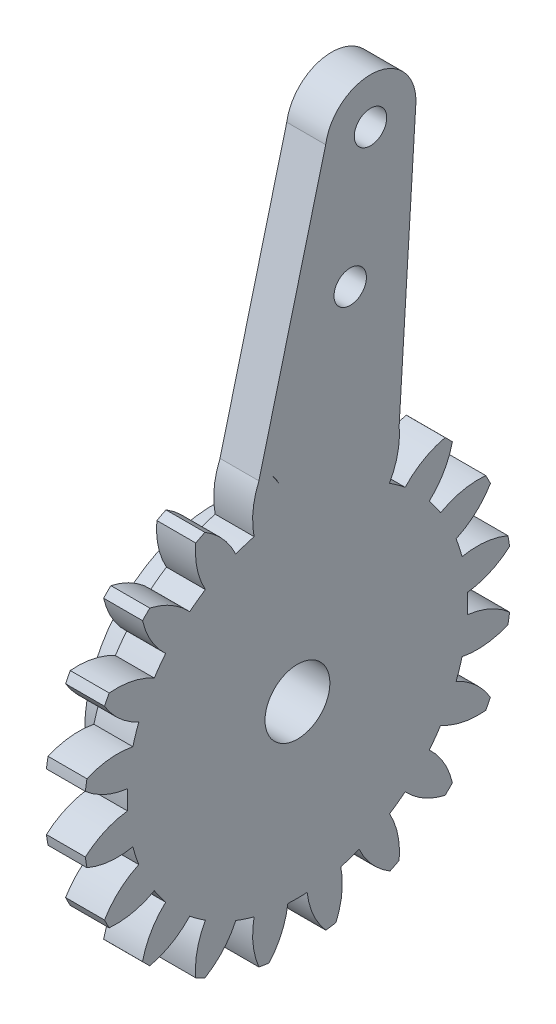
from build123d import *

# Parameters (mm, degrees)
BASPROSKE_W         = 3
BASPROSKE_H         = 16.5
TOOTHCUT_DEPTH      = 24.526580712
TEETHCUTS_COUNT     = 20
TEETHCUTS_ANGLE     = 342
SKETCH_3_R          = 2.5
CUT_EXTRUDE_2_DEPTH = 10
SKETCH_4_R          = 10
EXTRUDE_4_DEPTH     = 3.4
SKETCH_6_R          = 2.5
CUT_EXTRUDE_3_DEPTH = 24.997285258
SKETCH_2_R          = 1.25
EXTRUDE_5_DEPTH     = 3
SKETCH_7_R          = 2.5
CUT_EXTRUDE_4_DEPTH = 43.823439076
EXTRUDE_6_DEPTH     = 3
EXTRUDE_START       = -3
EXTRUDE_14_DEPTH    = 3


with BuildPart() as part:
    # BasProSke → Base-Revolve (revolve)
    with BuildSketch(Plane(origin=(0, 0, 0), x_dir=(1, 0, 0), z_dir=(0, 1, 0)), mode=Mode.PRIVATE) as base_revolve_sk:
        with Locations((1.5, 8.25)):
            Rectangle(BASPROSKE_W, BASPROSKE_H)
    revolve(base_revolve_sk.sketch.rotate(Axis((-10, 0, 0), (1, 0, 0)), 180), axis=Axis((-10, 0, 0), (1, 0, 0)))

    # TooCutSke → ToothCut (cut, through all)
    with BuildSketch(Plane(origin=(0, 0, 0), x_dir=(0, 0, -1), z_dir=(1, 0, 0))):
        with BuildLine():
            ThreePointArc((0.74381438, 13.102904875), (0, 13.124), (-0.74381438, 13.102904875))
            ThreePointArc((-0.74381438, 13.102904875), (-1.226473103, 14.852072512), (-2.209965745, 16.376962373))
            ThreePointArc((-2.209965745, 16.376962373), (0, 16.5254), (2.209965745, 16.376962373))
            ThreePointArc((2.209965745, 16.376962373), (1.226473103, 14.852072512), (0.74381438, 13.102904875))
        make_face()
    toothcut = extrude(amount=TOOTHCUT_DEPTH, mode=Mode.SUBTRACT)

    # TeethCuts: ToothCut ×20 about axis
    teethcuts_axis = Axis((-10, 0, 0), (1, 0, 0))
    for i in range(1, TEETHCUTS_COUNT):
        add(toothcut.rotate(teethcuts_axis, i * TEETHCUTS_ANGLE / (TEETHCUTS_COUNT - 1)), mode=Mode.SUBTRACT)

    # 草图3 → 切除-拉伸2 (cut)
    with BuildSketch(Plane.ZY):
        Circle(SKETCH_3_R)
        with Locations((0, 27)):
            Circle(SKETCH_3_R)
    extrude(amount=-CUT_EXTRUDE_2_DEPTH, mode=Mode.SUBTRACT)

    # 草图4 → 凸台-拉伸4 (add)
    with BuildSketch(Plane.ZY):
        with Locations(Location((0, 0, 0), (0, 0, 180))):
            Circle(SKETCH_4_R)
    extrude(amount=EXTRUDE_4_DEPTH)

    # 草图6 → 切除-拉伸3 (cut, through all)
    with BuildSketch(Plane.ZY.offset(3.4)):
        Circle(SKETCH_6_R)
    extrude(amount=-CUT_EXTRUDE_3_DEPTH, mode=Mode.SUBTRACT)

    # 草图2 → 凸台-拉伸5 (add)
    with BuildSketch(Plane.ZY):
        with BuildLine():
            Line((-3.456909192, -0.547520628), (-9.088549934, 35.009259634))
            ThreePointArc((-9.088549934, 35.009259634), (-6.179161369, 39.013689454), (-2.174731549, 36.104300889))
            Line((-2.174731549, 36.104300889), (3.456909192, 0.547520628))
            ThreePointArc((3.456909192, 0.547520628), (0.547520628, -3.456909192), (-3.456909192, -0.547520628))
        make_face()
        with Locations((-4.067296091, 25.679896855)):
            Circle(SKETCH_2_R, mode=Mode.SUBTRACT)
        with Locations((-5.631640741, 35.556780261)):
            Circle(SKETCH_2_R, mode=Mode.SUBTRACT)
    extrude(amount=-EXTRUDE_5_DEPTH)

    # 草图7 → 切除-拉伸4 (cut, through all)
    with BuildSketch(Plane(origin=(3, 0, 0), x_dir=(0, 0, -1), z_dir=(1, 0, 0))):
        with Locations(Location((0, 0, 0), (0, 0, 180))):
            Circle(SKETCH_7_R)
    extrude(amount=-CUT_EXTRUDE_4_DEPTH, mode=Mode.SUBTRACT)

    # 草图8 → 凸台-拉伸6 (add)
    with BuildSketch(Plane.ZY):
        Polygon((-7.841095822, 14.51782409), (-7.136285925, 14.87694267), (-5.713237213, 13.698373831), (-9.125006953, 35.341391045), align=None)
    extrude(amount=-EXTRUDE_6_DEPTH)

    # 草图9 → 凸台-拉伸14 (add)
    with BuildSketch(Plane.ZY.offset(EXTRUDE_START)):
        with BuildLine():
            Line((2.971070911, 16.230303067), (-2.174731549, 36.104300889))
            Line((-2.174731549, 36.104300889), (1.200581171, 14.793415086))
            Line((1.200581171, 14.793415086), (1.303832307, 15.021332463))
            Line((1.303832307, 15.021332463), (1.648552458, 15.68967923))
            Line((1.648552458, 15.68967923), (2.189783121, 16.354046896))
            ThreePointArc((2.189783121, 16.354046896), (2.581168673, 16.29685762), (2.971070911, 16.230303067))
        make_face()
    extrude(amount=EXTRUDE_14_DEPTH)


solid = part.part
